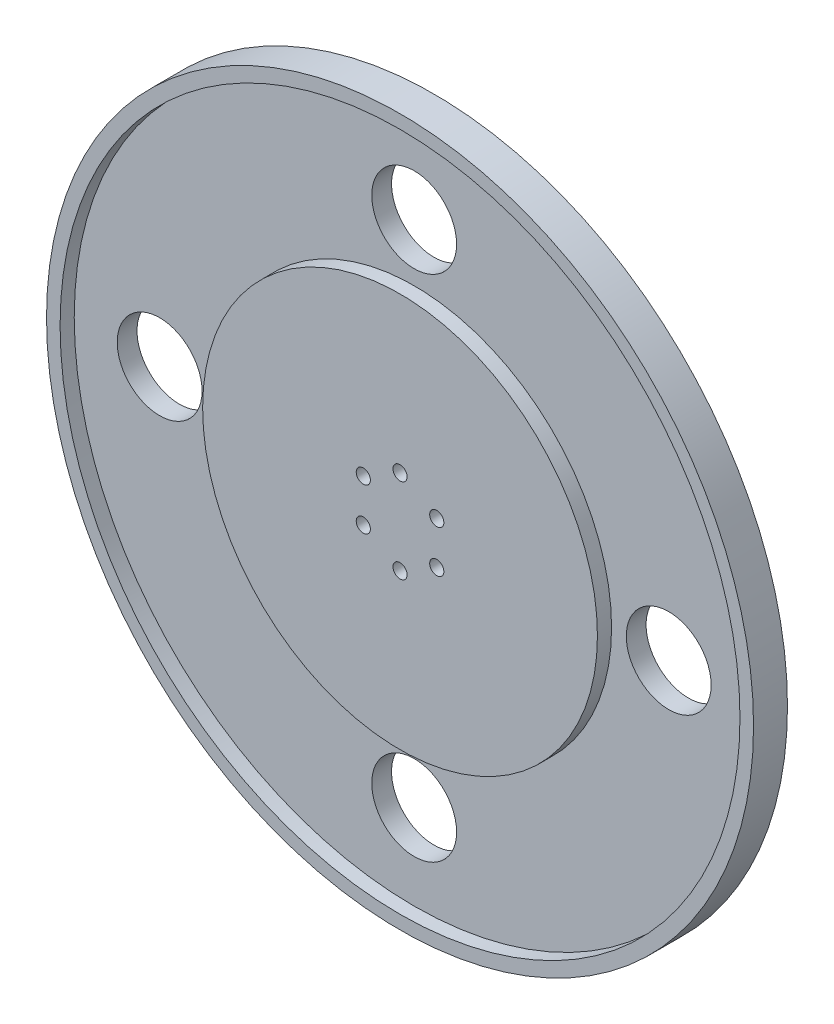
from build123d import *

# Parameters (mm, degrees)
SKETCH1_R             = 79.375
SKETCH1_R_2           = 76.327
BOSS_EXTRUDE1_DEPTH   = 7.62
SKETCH1_R_3           = 44.323
BOSS_EXTRUDE1_2_DEPTH = 7.62
SKETCH1_3_R           = 76.327
SKETCH1_3_R_2         = 44.323
BOSS_EXTRUDE2_DEPTH   = 4.445
CUT_EXTRUDE1_REACH    = 114.512
SKETCH2_R             = 1.5875
CUT_EXTRUDE2_REACH    = 114.341
SKETCH3_R             = 9.525


with BuildPart() as part:
    # Sketch1 → Boss-Extrude1 (new body)
    with BuildSketch(Plane.XY):
        Circle(SKETCH1_R)
        Circle(SKETCH1_R_2, mode=Mode.SUBTRACT)
    extrude(amount=BOSS_EXTRUDE1_DEPTH)



with BuildPart() as body_2:
    # Sketch1 → Boss-Extrude1 2 (new body)
    with BuildSketch(Plane.XY):
        Circle(SKETCH1_R_3)
    extrude(amount=BOSS_EXTRUDE1_2_DEPTH)


with BuildPart() as part_1:
    add(part.part)

    add(body_2.part)  # Boss-Extrude2 merges body 2
    # Sketch1<3> → Boss-Extrude2 (add)
    with BuildSketch(Plane.XY):
        Circle(SKETCH1_3_R)
        Circle(SKETCH1_3_R_2, mode=Mode.SUBTRACT)
    extrude(amount=BOSS_EXTRUDE2_DEPTH)

    # Sketch2 → Cut-Extrude1 (cut, up to next)
    with BuildSketch(Plane.XY.offset(7.62), mode=Mode.PRIVATE) as cut_extrude1_sk1:
        with Locations((0, 9.525)):
            Circle(SKETCH2_R)
    cut_extrude1_tool1 = extrude(cut_extrude1_sk1.sketch, amount=-CUT_EXTRUDE1_REACH, mode=Mode.PRIVATE) & part_1.part
    # Sketch2 → Cut-Extrude1 (cut, up to next)
    with BuildSketch(Plane.XY.offset(7.62), mode=Mode.PRIVATE) as cut_extrude1_sk2:
        with Locations((-8.248891971, 4.7625)):
            Circle(SKETCH2_R)
    cut_extrude1_tool2 = extrude(cut_extrude1_sk2.sketch, amount=-CUT_EXTRUDE1_REACH, mode=Mode.PRIVATE) & part_1.part
    # Sketch2 → Cut-Extrude1 (cut, up to next)
    with BuildSketch(Plane.XY.offset(7.62), mode=Mode.PRIVATE) as cut_extrude1_sk3:
        with Locations((8.248891971, 4.7625)):
            Circle(SKETCH2_R)
    cut_extrude1_tool3 = extrude(cut_extrude1_sk3.sketch, amount=-CUT_EXTRUDE1_REACH, mode=Mode.PRIVATE) & part_1.part
    # Sketch2 → Cut-Extrude1 (cut, up to next)
    with BuildSketch(Plane.XY.offset(7.62), mode=Mode.PRIVATE) as cut_extrude1_sk4:
        with Locations((-8.248891971, -4.7625)):
            Circle(SKETCH2_R)
    cut_extrude1_tool4 = extrude(cut_extrude1_sk4.sketch, amount=-CUT_EXTRUDE1_REACH, mode=Mode.PRIVATE) & part_1.part
    # Sketch2 → Cut-Extrude1 (cut, up to next)
    with BuildSketch(Plane.XY.offset(7.62), mode=Mode.PRIVATE) as cut_extrude1_sk5:
        with Locations((8.248891971, -4.7625)):
            Circle(SKETCH2_R)
    cut_extrude1_tool5 = extrude(cut_extrude1_sk5.sketch, amount=-CUT_EXTRUDE1_REACH, mode=Mode.PRIVATE) & part_1.part
    # Sketch2 → Cut-Extrude1 (cut, up to next)
    with BuildSketch(Plane.XY.offset(7.62), mode=Mode.PRIVATE) as cut_extrude1_sk6:
        with Locations((0, -9.525)):
            Circle(SKETCH2_R)
    cut_extrude1_tool6 = extrude(cut_extrude1_sk6.sketch, amount=-CUT_EXTRUDE1_REACH, mode=Mode.PRIVATE) & part_1.part
    add(cut_extrude1_tool1.solids().sort_by_distance((0, 9.525, 7.62))[0], mode=Mode.SUBTRACT)
    add(cut_extrude1_tool2.solids().sort_by_distance((-8.248892, 4.7625, 7.62))[0], mode=Mode.SUBTRACT)
    add(cut_extrude1_tool3.solids().sort_by_distance((8.248892, 4.7625, 7.62))[0], mode=Mode.SUBTRACT)
    add(cut_extrude1_tool4.solids().sort_by_distance((-8.248892, -4.7625, 7.62))[0], mode=Mode.SUBTRACT)
    add(cut_extrude1_tool5.solids().sort_by_distance((8.248892, -4.7625, 7.62))[0], mode=Mode.SUBTRACT)
    add(cut_extrude1_tool6.solids().sort_by_distance((0, -9.525, 7.62))[0], mode=Mode.SUBTRACT)

    # Sketch3 → Cut-Extrude2 (cut, up to next)
    with BuildSketch(Plane.XY.offset(4.445), mode=Mode.PRIVATE) as cut_extrude2_sk1:
        with Locations((57.15, 0)):
            Circle(SKETCH3_R)
    cut_extrude2_tool1 = extrude(cut_extrude2_sk1.sketch, amount=-CUT_EXTRUDE2_REACH, mode=Mode.PRIVATE) & part_1.part
    # Sketch3 → Cut-Extrude2 (cut, up to next)
    with BuildSketch(Plane.XY.offset(4.445), mode=Mode.PRIVATE) as cut_extrude2_sk2:
        with Locations((0, 57.15)):
            Circle(SKETCH3_R)
    cut_extrude2_tool2 = extrude(cut_extrude2_sk2.sketch, amount=-CUT_EXTRUDE2_REACH, mode=Mode.PRIVATE) & part_1.part
    # Sketch3 → Cut-Extrude2 (cut, up to next)
    with BuildSketch(Plane.XY.offset(4.445), mode=Mode.PRIVATE) as cut_extrude2_sk3:
        with Locations((0, -57.15)):
            Circle(SKETCH3_R)
    cut_extrude2_tool3 = extrude(cut_extrude2_sk3.sketch, amount=-CUT_EXTRUDE2_REACH, mode=Mode.PRIVATE) & part_1.part
    # Sketch3 → Cut-Extrude2 (cut, up to next)
    with BuildSketch(Plane.XY.offset(4.445), mode=Mode.PRIVATE) as cut_extrude2_sk4:
        with Locations((-57.15, 0)):
            Circle(SKETCH3_R)
    cut_extrude2_tool4 = extrude(cut_extrude2_sk4.sketch, amount=-CUT_EXTRUDE2_REACH, mode=Mode.PRIVATE) & part_1.part
    add(cut_extrude2_tool1.solids().sort_by_distance((57.15, 0, 4.445))[0], mode=Mode.SUBTRACT)
    add(cut_extrude2_tool2.solids().sort_by_distance((0, 57.15, 4.445))[0], mode=Mode.SUBTRACT)
    add(cut_extrude2_tool3.solids().sort_by_distance((0, -57.15, 4.445))[0], mode=Mode.SUBTRACT)
    add(cut_extrude2_tool4.solids().sort_by_distance((-57.15, 0, 4.445))[0], mode=Mode.SUBTRACT)


solid = part_1.part
